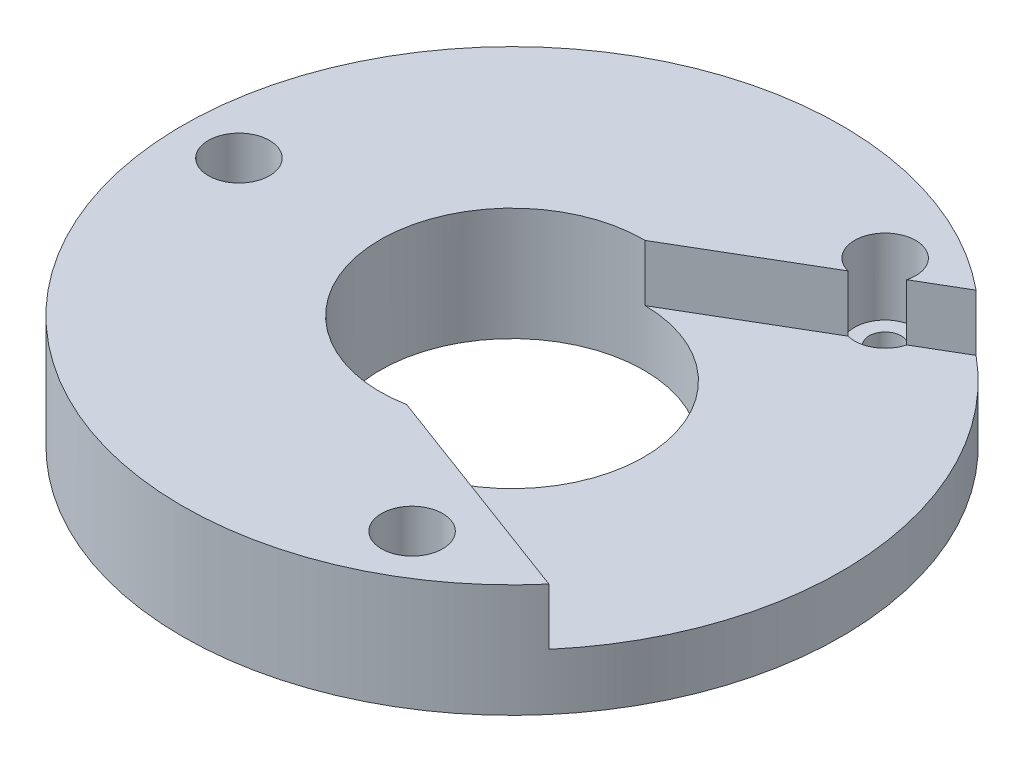
from build123d import *

# Parameters (mm, degrees)
SKETCH_1_R          = 35
SKETCH_1_R_2        = 1.7
EXTRUDE_1_DEPTH     = 12
CUT_EXTRUDE_1_DEPTH = 6
SKETCH_4_R          = 14
CUT_EXTRUDE_3_DEPTH = 51.931326313
SKETCH_5_R          = 3.25
CUT_EXTRUDE_4_DEPTH = 8


with BuildPart() as part:
    # 草图1 → 凸台-拉伸1 (new body)
    with BuildSketch(Plane(origin=(0, 0, 0), x_dir=(1, 0, 0), z_dir=(0, 1, 0))):
        with Locations(Location((0, 0, 0), (0, 0, 270))):
            Circle(SKETCH_1_R)
        with Locations(Location((14.5, 25.11473671, 0), (0, 0, 270))):
            Circle(SKETCH_1_R_2, mode=Mode.SUBTRACT)
        with Locations(Location((14.5, -25.11473671, 0), (0, 0, 270))):
            Circle(SKETCH_1_R_2, mode=Mode.SUBTRACT)
        with Locations(Location((-29, 0, 0), (0, 0, 270))):
            Circle(SKETCH_1_R_2, mode=Mode.SUBTRACT)
    extrude(amount=EXTRUDE_1_DEPTH)

    # 草图2 → 切除-拉伸1 (cut)
    with BuildSketch(Plane(origin=(0, 12, 0), x_dir=(1, 0, 0), z_dir=(0, 1, 0))):
        with BuildLine():
            Line((35.785871092, 34.919499283), (-6.074470585, 10.348951981))
            ThreePointArc((-6.074470585, 10.348951981), (-11.954336377, -1.045868913), (-4.185109075, -11.246548894))
            Line((-4.185109075, -11.246548894), (41.305910715, -28.174842324))
            ThreePointArc((41.305910715, -28.174842324), (49.809734905, 4.357787137), (35.785871092, 34.919499283))
        make_face()
    extrude(amount=-CUT_EXTRUDE_1_DEPTH, mode=Mode.SUBTRACT)

    # 草图4 → 切除-拉伸3 (cut, through all)
    with BuildSketch(Plane.XZ):
        with Locations(Location((0, 0, 0), (0, 0, 270))):
            Circle(SKETCH_4_R)
    extrude(amount=-CUT_EXTRUDE_3_DEPTH, mode=Mode.SUBTRACT)

    # 草图5 → 切除-拉伸4 (cut)
    with BuildSketch(Plane(origin=(0, 12, 0), x_dir=(1, 0, 0), z_dir=(0, 1, 0))):
        with Locations(Location((14.5, 25.11473671, 0), (0, 0, 270))):
            Circle(SKETCH_5_R)
        with Locations(Location((14.5, -25.11473671, 0), (0, 0, 270))):
            Circle(SKETCH_5_R)
        with Locations(Location((-29, 0, 0), (0, 0, 270))):
            Circle(SKETCH_5_R)
    extrude(amount=-CUT_EXTRUDE_4_DEPTH, mode=Mode.SUBTRACT)


solid = part.part
